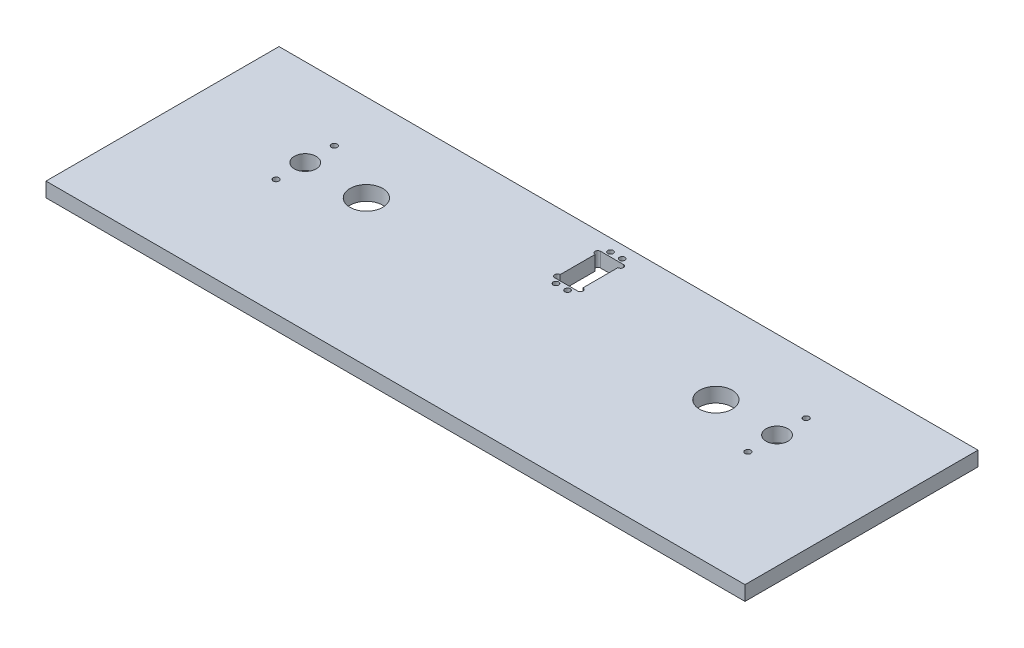
from build123d import *

# Parameters (mm, degrees)
SKETCH1_W           = 304.8
SKETCH1_H           = 203.2
SKETCH1_R           = 14.2875
SKETCH1_R_2         = 9.525
SKETCH1_R_3         = 2.54
BOSS_EXTRUDE1_DEPTH = 12.7
SKETCH5_R           = 2.38379
CUT_EXTRUDE2_DEPTH  = 475.681082412


with BuildPart() as part:
    # Sketch1 → Boss-Extrude1 (new body)
    with BuildSketch(Plane(origin=(0, 0, 0), x_dir=(1, 0, 0), z_dir=(0, 1, 0))):
        with Locations((0, -25.4)):
            Rectangle(SKETCH1_W, SKETCH1_H)
        with Locations(Location((0, 0, 0), (0, 0, 270))):
            Circle(SKETCH1_R, mode=Mode.SUBTRACT)
        with Locations(Location((-53.34, 0, 0), (0, 0, 270))):
            Circle(SKETCH1_R_2, mode=Mode.SUBTRACT)
        with Locations(Location((-53.34, 25.4, 0), (0, 0, 270))):
            Circle(SKETCH1_R_3, mode=Mode.SUBTRACT)
        with Locations(Location((-53.34, -25.4, 0), (0, 0, 270))):
            Circle(SKETCH1_R_3, mode=Mode.SUBTRACT)
    boss_extrude1 = extrude(amount=BOSS_EXTRUDE1_DEPTH)

    # Mirror1: Boss-Extrude1 across plane
    add(boss_extrude1.mirror(Plane(origin=(152.4, 12.7, -76.2), x_dir=(0, 0, 1), z_dir=(-1, 0, 0))))

    # Sketch5 → Cut-Extrude2 (cut, through all)
    with BuildSketch(Plane(origin=(0, 12.7, 0), x_dir=(1, 0, 0), z_dir=(0, 1, 0))):
        with Locations(Location((157.48, 65.607045243, 0), (0, 0, 270))):
            Circle(SKETCH5_R)
        with Locations(Location((147.32, 65.607045243, 0), (0, 0, 270))):
            Circle(SKETCH5_R)
        with Locations(Location((147.32, 17.982045243, 0), (0, 0, 270))):
            Circle(SKETCH5_R)
        with Locations(Location((157.48, 17.982045243, 0), (0, 0, 270))):
            Circle(SKETCH5_R)
        with BuildLine():
            Line((142.4305, 21.792045243), (162.3695, 21.792045243))
            ThreePointArc((162.3695, 21.792045243), (164.7571, 24.179645243), (162.3695, 26.567245243))
            Line((162.3695, 26.567245243), (162.3695, 57.021845243))
            ThreePointArc((162.3695, 57.021845243), (164.7571, 59.409445243), (162.3695, 61.797045243))
            Line((162.3695, 61.797045243), (142.4305, 61.797045243))
            ThreePointArc((142.4305, 61.797045243), (140.0429, 59.409445243), (142.4305, 57.021845243))
            Line((142.4305, 57.021845243), (142.4305, 26.567245243))
            ThreePointArc((142.4305, 26.567245243), (140.0429, 24.179645243), (142.4305, 21.792045243))
        make_face()
    extrude(amount=-CUT_EXTRUDE2_DEPTH, mode=Mode.SUBTRACT)


solid = part.part
